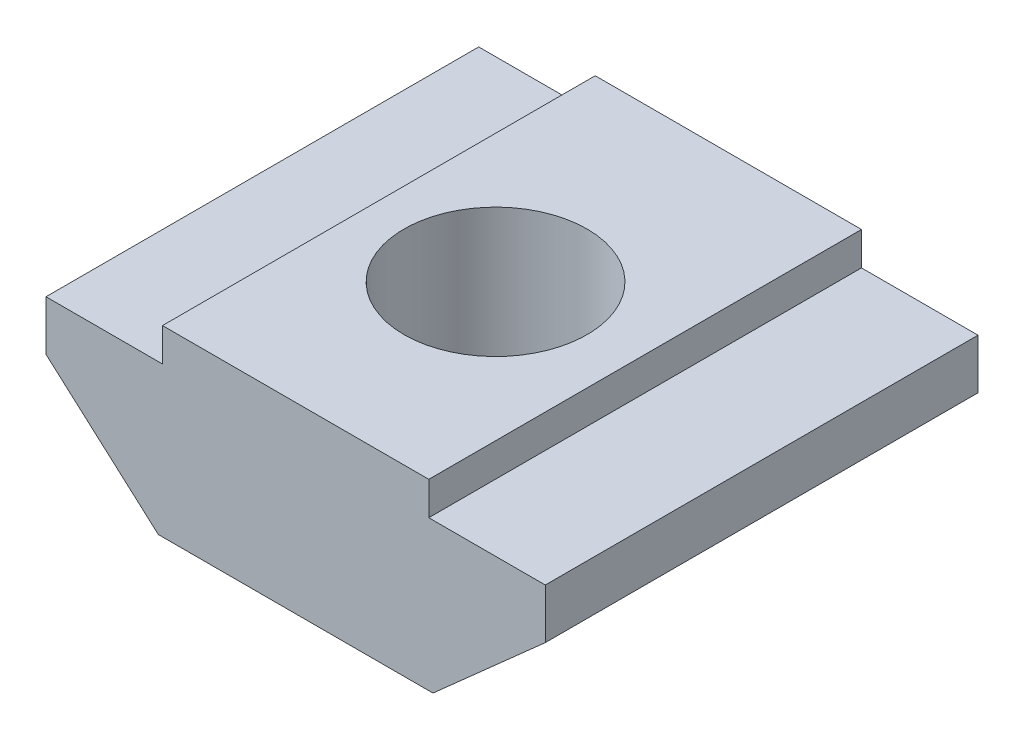
from build123d import *

# Parameters (mm, degrees)
EXTRUDE_1_DEPTH = 13


with BuildPart() as part:
    # Эскиз1 → Бобышка-Вытянуть1 (new body)
    with BuildSketch(Plane.XY):
        Polygon((-4.461885495, 0), (3.788114505, 0), (7.163114505, 3), (7.163114505, 4.5), (3.663114505, 4.5), (3.663114505, 5.5), (-4.336885495, 5.5), (-4.336885495, 4.5), (-7.836885495, 4.5), (-7.836885495, 3), align=None)
    extrude(amount=EXTRUDE_1_DEPTH)

    # Эскиз4 → Зенковка для  винта с плоской головкой M52 (revolve, cut)
    with BuildSketch(Plane(origin=(-0.471799648, 5.5, 6.859193471), x_dir=(0, 0, 1), z_dir=(1, 0, 0))):
        Polygon((0, 0), (0, 5.5), (2.75, 5.5), (2.75, 2.45), (2.75, 0), align=None)
    revolve(axis=Axis((-0.471799648, 11.85, 6.859193471), (0, -1, 0)), mode=Mode.SUBTRACT)


solid = part.part
